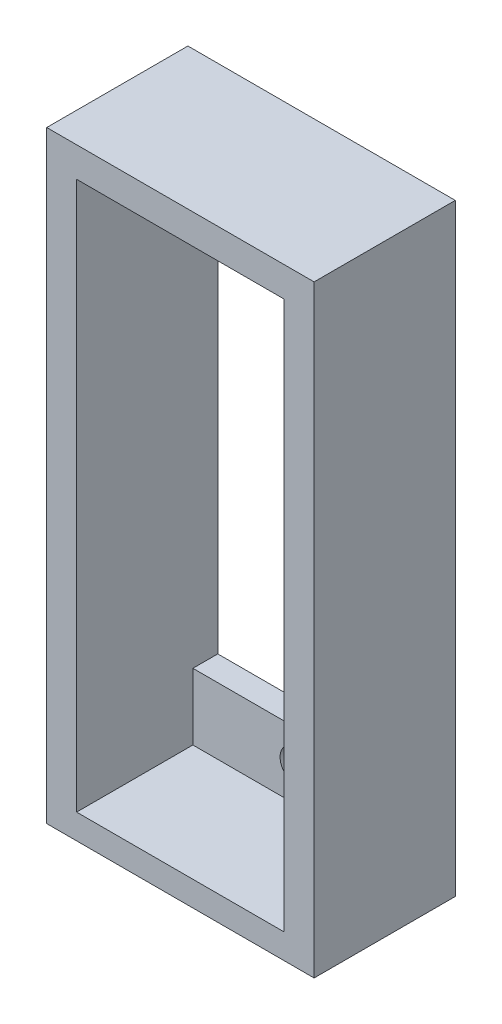
from build123d import *

# Parameters (mm, degrees)
CROQUIS1_R              = 31.5
SALIENTE_EXTRUIR1_DEPTH = 2.4
CROQUIS2_W              = 16.1
CROQUIS2_H              = 36.3
CROQUIS2_W_2            = 12.5
CROQUIS2_H_2            = 33
SALIENTE_EXTRUIR2_DEPTH = 22.5
CROQUIS5_W              = 16.1
CROQUIS5_H              = 36.3
CORTAR_EXTRUIR2_DEPTH   = 9
CROQUIS6_R              = 1.5
CORTAR_EXTRUIR3_DEPTH   = 2.4
CROQUIS7_W              = 12.5
CROQUIS7_H              = 9
SALIENTE_EXTRUIR3_DEPTH = 33
CROQUIS8_R              = 1
CORTAR_EXTRUIR5_DEPTH   = 9
SALIENTE_EXTRUIR4_DEPTH = 12.5
CROQUIS10_W             = 4
CROQUIS10_H             = 2
CORTAR_EXTRUIR6_DEPTH   = 9
SALIENTE_EXTRUIR5_DEPTH = 2.4
SALIENTE_EXTRUIR6_DEPTH = 16.099998
CORTAR_EXTRUIR7_DEPTH   = 1.8
CROQUIS14_R             = 1.5
SALIENTE_EXTRUIR7_DEPTH = 0.6
CORTAR_EXTRUIR8_START   = -17
CROQUIS17_R             = 41.453169239
CORTAR_EXTRUIR8_DEPTH   = 17


with BuildPart() as part:
    # Croquis1 → Saliente-Extruir1 (new body)
    with BuildSketch(Plane.XY):
        with Locations((-51.235671923, 9.786589019)):
            Circle(CROQUIS1_R)
    extrude(amount=SALIENTE_EXTRUIR1_DEPTH)

    # Croquis2 → Saliente-Extruir2 (add)
    with BuildSketch(Plane.XY.offset(2.4)):
        with Locations((-51.235671923, 4.936589019)):
            Rectangle(CROQUIS2_W, CROQUIS2_H)
        with Locations((-51.235671923, 4.786589019)):
            Rectangle(CROQUIS2_W_2, CROQUIS2_H_2, mode=Mode.SUBTRACT)
    extrude(amount=SALIENTE_EXTRUIR2_DEPTH)

    # Croquis5 → Cortar-Extruir2 (cut)
    with BuildSketch(Plane.XY.offset(2.4)):
        with Locations((-51.235671923, 4.936589019)):
            Rectangle(CROQUIS5_W, CROQUIS5_H)
    extrude(amount=-CORTAR_EXTRUIR2_DEPTH, mode=Mode.SUBTRACT)


with BuildPart() as cortar_extruir2_piece_1:
    # of the separate pieces the step leaves, piece 1, a body of its own (cortar_extruir2_pieces)
    add(part.part.solids().sort_by_distance((-19.735671923, 9.786589019, 0))[0])

    # Croquis6 → Cortar-Extruir3 (cut)
    with BuildSketch(Plane(origin=(0, 0, 0), x_dir=(-1, 0, 0), z_dir=(0, 0, -1))):
        with Locations((34.618662565, 26.403598377)):
            Circle(CROQUIS6_R)
        with Locations((67.85268128, 26.403598377)):
            Circle(CROQUIS6_R)
        with Locations((67.85268128, -6.830420339)):
            Circle(CROQUIS6_R)
        with Locations((34.618662565, -6.830420339)):
            Circle(CROQUIS6_R)
        Polygon((51.235671923, 23.086589019), (53.235671923, 23.086589019), (53.235671923, 43.086589019), (49.235671923, 43.086589019), (49.235671923, 23.086589019), align=None)
    extrude(amount=-CORTAR_EXTRUIR3_DEPTH, mode=Mode.SUBTRACT)



with BuildPart() as cortar_extruir2_piece_2:
    # of the separate pieces the step leaves, piece 2, a body of its own (cortar_extruir2_pieces)
    add(part.part.solids().sort_by_distance((-59.285671923, -13.213410981, 24.9))[0])

    # Croquis7 → Saliente-Extruir3 (add)
    with BuildSketch(Plane.XZ.offset(-21.286589019)):
        with Locations((-51.235671923, 13.4)):
            Rectangle(CROQUIS7_W, CROQUIS7_H)
    extrude(amount=SALIENTE_EXTRUIR3_DEPTH)

    # Croquis8 → Cortar-Extruir5 (cut)
    with BuildSketch(Plane.XY.offset(17.9)):
        with Locations((-51.235671923, -9.713410981)):
            Circle(CROQUIS8_R)
        with Locations((-51.235671923, 18.336589019)):
            Circle(CROQUIS8_R)
        Polygon((-44.985671923, -7.713410981), (-57.485671923, -7.713410981), (-57.485671923, 15.286589019), (-53.235671923, 15.286589019), (-53.235671923, 17.286589019), (-49.235671923, 17.286589019), (-49.235671923, 15.286589019), (-44.985671923, 15.286589019), align=None)
    extrude(amount=-CORTAR_EXTRUIR5_DEPTH, mode=Mode.SUBTRACT)

    # Croquis9 → Saliente-Extruir4 (add)
    with BuildSketch(Plane.ZY.offset(44.985671923)):
        Polygon((8.9, -7.713410981), (3.9, -11.713410981), (8.9, -11.713410981), align=None)
        Polygon((8.9, 15.286589019), (4.1, 21.286589019), (8.9, 21.286589019), align=None)
    extrude(amount=SALIENTE_EXTRUIR4_DEPTH)

    # Croquis10 → Cortar-Extruir6 (cut)
    with BuildSketch(Plane.XY.offset(8.9)):
        with Locations((-51.235671923, 16.286589019)):
            Rectangle(CROQUIS10_W, CROQUIS10_H)
    extrude(amount=-CORTAR_EXTRUIR6_DEPTH, mode=Mode.SUBTRACT)


with BuildPart() as cortar_extruir2_piece_1_1:
    add(cortar_extruir2_piece_1.part)

    add(cortar_extruir2_piece_2.part)  # Saliente-Extruir5 merges Cortar-Extruir2 piece 2
    # Croquis11 → Saliente-Extruir5 (add)
    with BuildSketch(Plane(origin=(0, 0, 2.4), x_dir=(-1, 0, 0), z_dir=(0, 0, -1))):
        Polygon((49.235671923, 23.086589019), (43.185671923, 23.086589019), (43.185671923, -13.213410981), (59.285671923, -13.213410981), (59.285671923, 23.086589019), (53.235671923, 23.086589019), (53.235671923, 21.286589019), (57.485671923, 21.286589019), (57.485671923, 10.586589019), (44.985671923, 10.586589019), (44.985671923, 21.286589019), (49.235671923, 21.286589019), align=None)
    extrude(amount=SALIENTE_EXTRUIR5_DEPTH)

    # Croquis12 → Saliente-Extruir6 (add)
    with BuildSketch(Plane(origin=(-43.185671923, 0, 0), x_dir=(0, 0, -1), z_dir=(1, 0, 0))):
        Polygon((-2.4, 23.086589019), (-7.4, 23.086589019), (-2.4, 29.386589019), align=None)
    extrude(amount=-SALIENTE_EXTRUIR6_DEPTH)

    # Croquis13 → Cortar-Extruir7 (cut)
    with BuildSketch(Plane.XY.offset(2.4)):
        Polygon((-31.385501057, -6.830420339), (-33.002081811, -4.030420339), (-36.235243318, -4.030420339), (-37.851824072, -6.830420339), (-36.235243318, -9.630420339), (-33.002081811, -9.630420339), align=None)
        Polygon((-64.619519773, -6.830420339), (-66.236100527, -4.030420339), (-69.469262034, -4.030420339), (-71.085842788, -6.830420339), (-69.469262034, -9.630420339), (-66.236100527, -9.630420339), align=None)
        Polygon((-37.851824072, 26.403598377), (-36.235243318, 23.603598377), (-33.002081811, 23.603598377), (-31.385501057, 26.403598377), (-33.002081811, 29.203598377), (-36.235243318, 29.203598377), align=None)
        Polygon((-71.085842788, 26.403598377), (-69.469262034, 23.603598377), (-66.236100527, 23.603598377), (-64.619519773, 26.403598377), (-66.236100527, 29.203598377), (-69.469262034, 29.203598377), align=None)
    extrude(amount=-CORTAR_EXTRUIR7_DEPTH, mode=Mode.SUBTRACT)

    # Croquis14 → Saliente-Extruir7 (add)
    with BuildSketch(Plane(origin=(0, 0, 0), x_dir=(-1, 0, 0), z_dir=(0, 0, -1))):
        with BuildLine():
            Line((53.235671923, 41.223032838), (53.235671923, 21.286589019))
            Line((53.235671923, 21.286589019), (57.485671923, 21.286589019))
            Line((57.485671923, 21.286589019), (57.485671923, 10.586589019))
            Line((57.485671923, 10.586589019), (44.985671923, 10.586589019))
            Line((44.985671923, 10.586589019), (44.985671923, 21.286589019))
            Line((44.985671923, 21.286589019), (49.235671923, 21.286589019))
            Line((49.235671923, 21.286589019), (49.235671923, 41.223032838))
            ThreePointArc((49.235671923, 41.223032838), (51.235671923, -21.713410981), (53.235671923, 41.223032838))
        make_face()
        with Locations((67.85268128, -6.830420339)):
            Circle(CROQUIS14_R, mode=Mode.SUBTRACT)
        with Locations((34.618662565, -6.830420339)):
            Circle(CROQUIS14_R, mode=Mode.SUBTRACT)
        with Locations((34.618662565, 26.403598377)):
            Circle(CROQUIS14_R, mode=Mode.SUBTRACT)
        with Locations((67.85268128, 26.403598377)):
            Circle(CROQUIS14_R, mode=Mode.SUBTRACT)
    extrude(amount=SALIENTE_EXTRUIR7_DEPTH)

    # Croquis17 → Cortar-Extruir8 (cut)
    with BuildSketch(Plane.XY.offset(16.4).offset(CORTAR_EXTRUIR8_START)):
        with Locations((-51.749775456, 10.131791007)):
            Circle(CROQUIS17_R)
    extrude(amount=CORTAR_EXTRUIR8_DEPTH, mode=Mode.SUBTRACT)


solid = cortar_extruir2_piece_1_1.part
